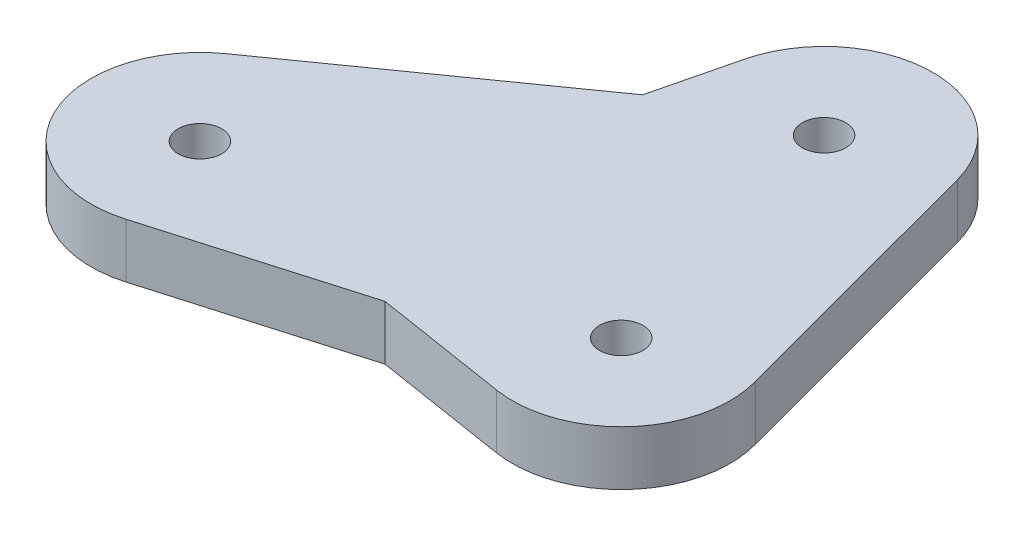
from build123d import *

# Parameters (mm, degrees)
SKIZZE1_R                       = 2
AUFSATZ_LINEAR_AUSTRAGEN1_DEPTH = 5


with BuildPart() as part:
    # Skizze1 → Aufsatz-Linear austragen1 (new body)
    with BuildSketch(Plane(origin=(0, 0, 0), x_dir=(1, 0, 0), z_dir=(0, 1, 0))):
        with BuildLine():
            Line((32.174930969, -0.758710751), (25.406405474, 24.546237926))
            ThreePointArc((25.406405474, 24.546237926), (15.641921228, 31.961749958), (6.033920269, 24.344579298))
            Line((6.033920269, 24.344579298), (4.193711044, 16.842429276))
            Line((4.193711044, 16.842429276), (-18.224781404, 0.973862232))
            ThreePointArc((-18.224781404, 0.973862232), (-21.454022597, -11.53334461), (-9.654845468, -16.790495999))
            Line((-9.654845468, -16.790495999), (8.801061186, -11.423209418))
            Line((8.801061186, -11.423209418), (20.984655174, -13.357550953))
            ThreePointArc((20.984655174, -13.357550953), (30.029331036, -10.12200662), (32.174930969, -0.758710751))
        make_face()
        with Locations(Location((22.552676727, -3.481250613, 0), (0, 0, 270))):
            Circle(SKIZZE1_R, mode=Mode.SUBTRACT)
        with Locations(Location((-12.447323273, -7.188305222, 0), (0, 0, 270))):
            Circle(SKIZZE1_R, mode=Mode.SUBTRACT)
        with Locations(Location((15.746010972, 21.962291706, 0), (0, 0, 270))):
            Circle(SKIZZE1_R, mode=Mode.SUBTRACT)
    extrude(amount=AUFSATZ_LINEAR_AUSTRAGEN1_DEPTH)


solid = part.part
